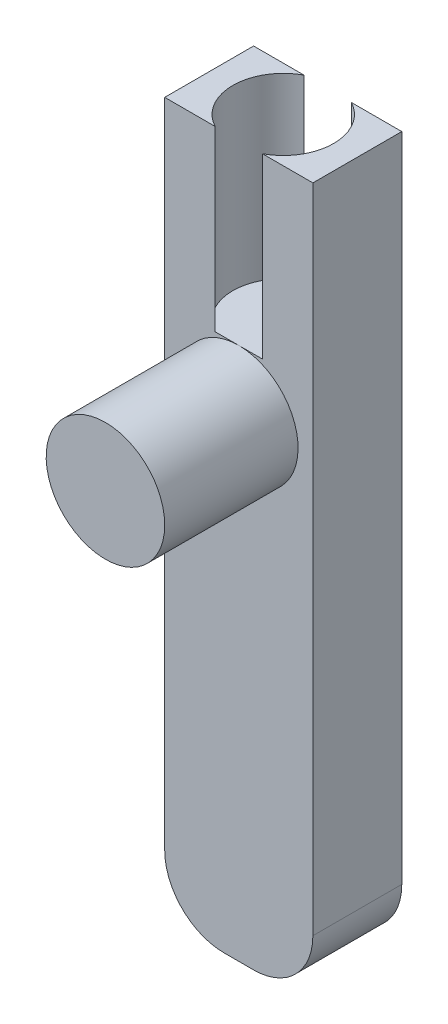
from build123d import *

# Parameters (mm, degrees)
EXTRUDE_1_DEPTH     = 1.5
SKETCH_2_R          = 1
EXTRUDE_2_DEPTH     = 2.25
SKETCH_3_R          = 0.85
CUT_EXTRUDE_1_DEPTH = 3


with BuildPart() as part:
    # Эскиз1 → Бобышка-Вытянуть1 (new body)
    with BuildSketch(Plane.XY):
        with BuildLine():
            Line((-1, 0), (-1.5, 0))
            ThreePointArc((-1.5, 0), (-2.207106781, 0.292893219), (-2.5, 1))
            Line((-2.5, 1), (-2.5, 12))
            Line((-2.5, 12), (0, 12))
            Line((0, 12), (0, 1))
            ThreePointArc((0, 1), (-0.292893219, 0.292893219), (-1, 0))
        make_face()
    extrude(amount=EXTRUDE_1_DEPTH)

    # Эскиз2 → Бобышка-Вытянуть2 (add)
    with BuildSketch(Plane.XY.offset(1.5)):
        with Locations((-1.25, 8)):
            Circle(SKETCH_2_R)
    extrude(amount=EXTRUDE_2_DEPTH)

    # Эскиз3 → Вырез-Вытянуть1 (cut)
    with BuildSketch(Plane(origin=(0, 12, 0), x_dir=(1, 0, 0), z_dir=(0, 1, 0))):
        with Locations((-1.25, -0.75)):
            Circle(SKETCH_3_R)
    extrude(amount=-CUT_EXTRUDE_1_DEPTH, mode=Mode.SUBTRACT)


solid = part.part
